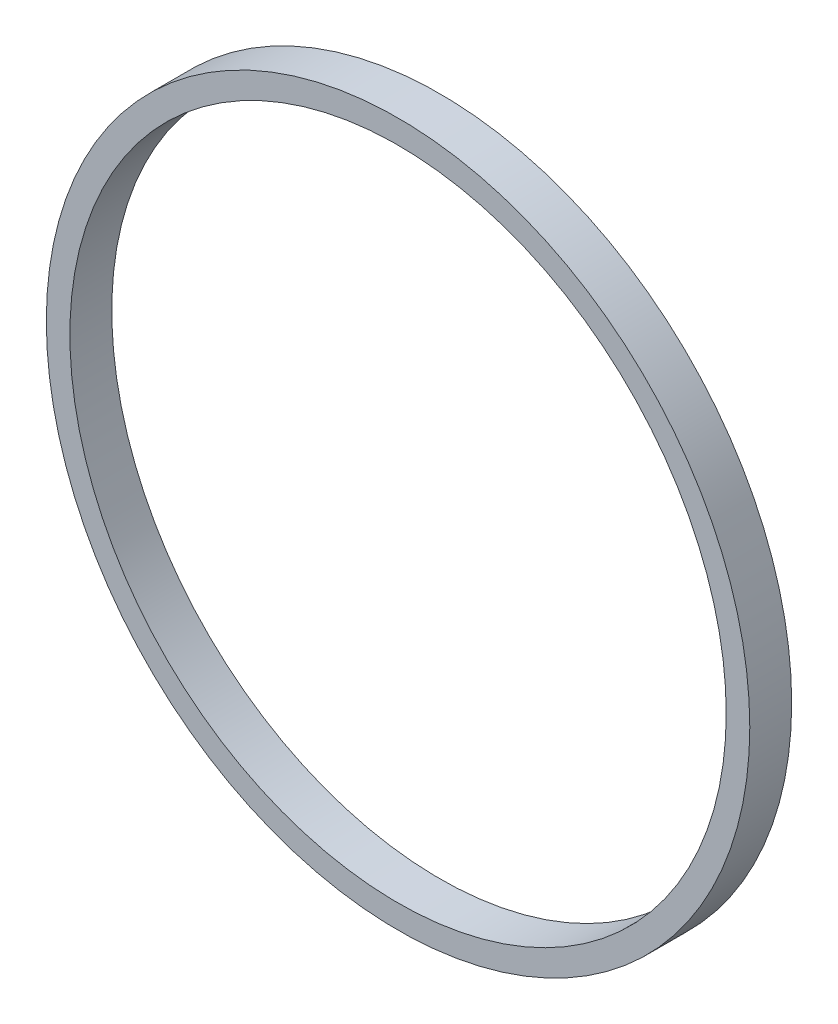
from build123d import *

# Parameters (mm, degrees)
SKETCH1_R           = 26.87
SKETCH1_R_2         = 25.07
BOSS_EXTRUDE1_DEPTH = 3.2


with BuildPart() as part:
    # Sketch1 → Boss-Extrude1 (new body)
    with BuildSketch(Plane.XY):
        Circle(SKETCH1_R)
        Circle(SKETCH1_R_2, mode=Mode.SUBTRACT)
    extrude(amount=BOSS_EXTRUDE1_DEPTH)


solid = part.part
